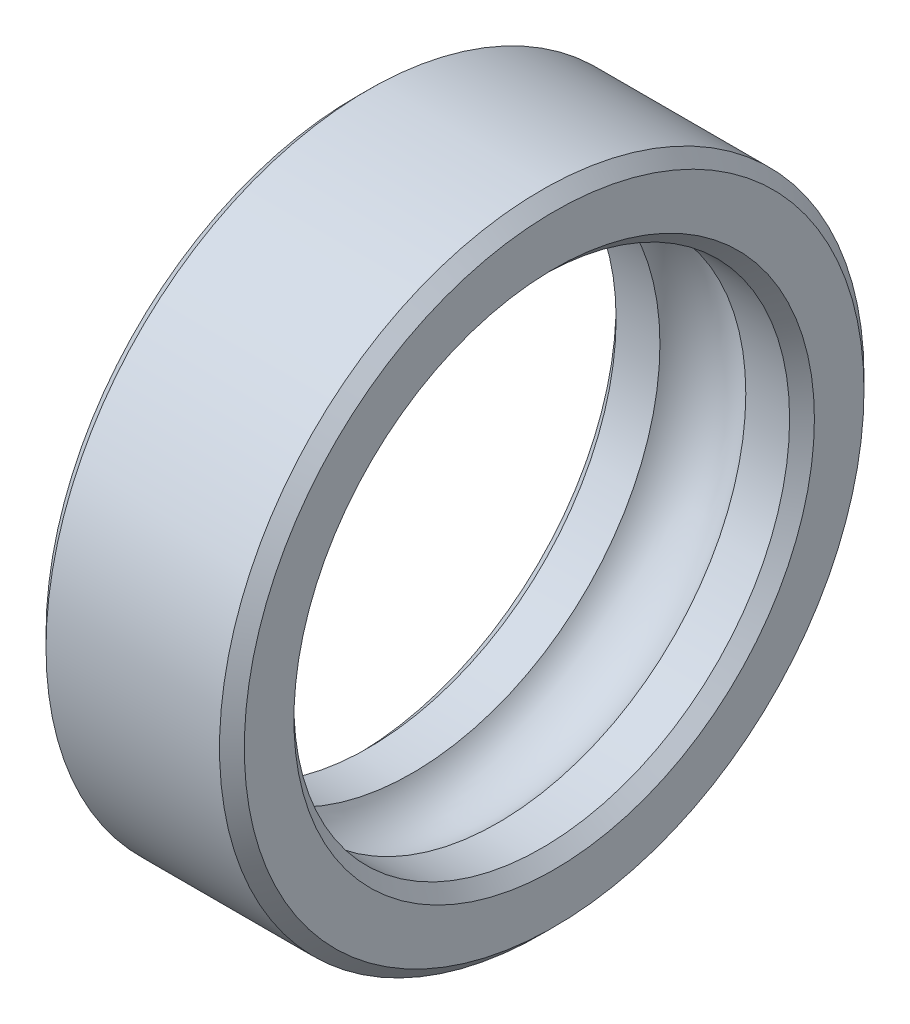
from build123d import *

# Parameters (mm, degrees)
PAH1_SIZE = 0.5


with BuildPart() as part:
    # Çizim1 → Döndür1 (revolve)
    with BuildSketch(Plane.XY, mode=Mode.PRIVATE) as d_nd_r1_sk:
        with BuildLine():
            Line((0, 10), (0, 13))
            Line((0, 13), (-8, 13))
            Line((-8, 13), (-8, 10))
            Line((-8, 10), (-5.732050808, 10))
            ThreePointArc((-5.732050808, 10), (-4, 11), (-2.267949192, 10))
            Line((-2.267949192, 10), (0, 10))
        make_face()
    revolve(d_nd_r1_sk.sketch.rotate(Axis((0, 0, 0), (-1, 0, 0)), 90), axis=Axis((0, 0, 0), (-1, 0, 0)))

    # Pah1
    pah1_edges = [part.edges().sort_by_distance(p)[0] for p in [
        (0, 0, 10),
        (0, 0, 13),
        (-8, 0, 13),
        (-8, 0, 10),
    ]]
    chamfer(pah1_edges, length=PAH1_SIZE)


solid = part.part
